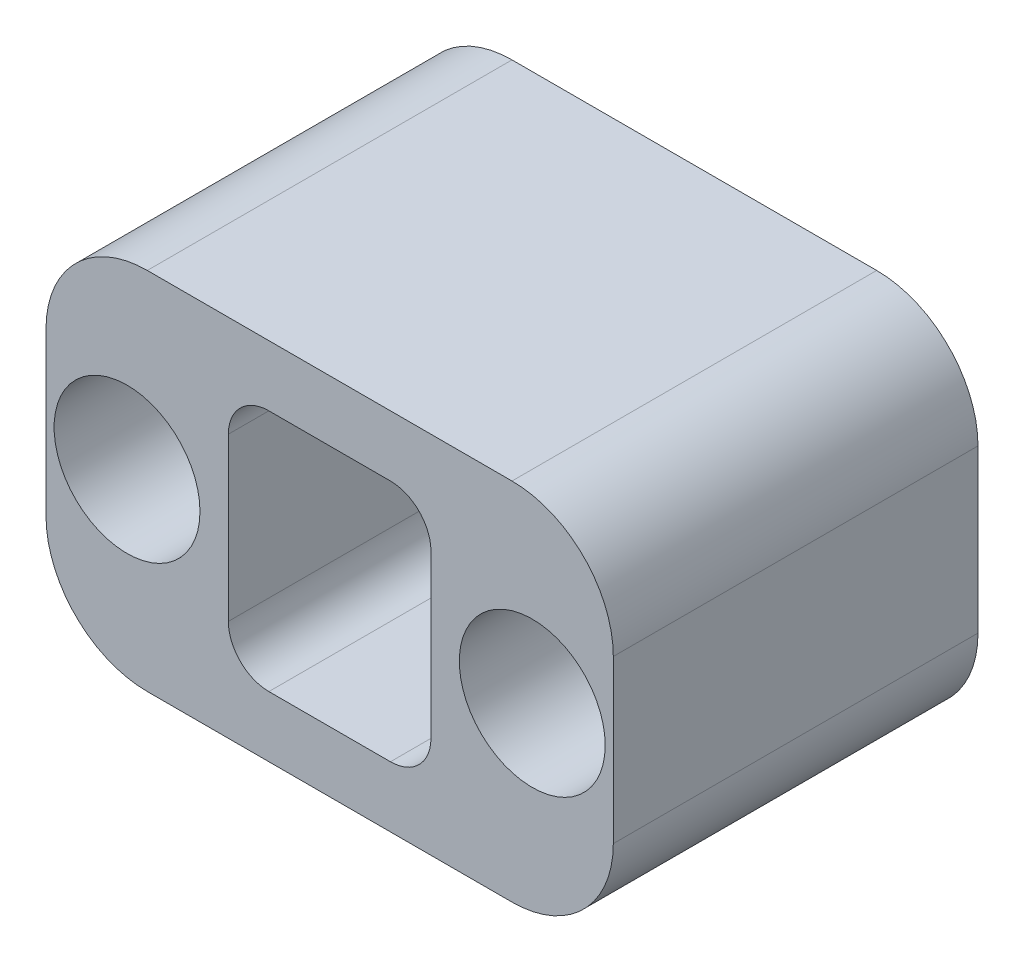
from build123d import *

# Parameters (mm, degrees)
SKETCH_1_W          = 28
SKETCH_1_H          = 18
SKETCH_1_R          = 2.1
EXTRUDE_1_DEPTH     = 18
SKETCH_2_R          = 3.6
CUT_EXTRUDE_1_DEPTH = 15
SKETCH_3_W          = 10
SKETCH_3_H          = 12
CUT_EXTRUDE_2_DEPTH = 25
FILLET_1_R          = 2
FILLET_2_R          = 5


with BuildPart() as part:
    # 草图1 → 凸台-拉伸1 (new body)
    with BuildSketch(Plane.XY):
        Rectangle(SKETCH_1_W, SKETCH_1_H)
        with Locations((-10, 0)):
            Circle(SKETCH_1_R, mode=Mode.SUBTRACT)
        with Locations((10, 0)):
            Circle(SKETCH_1_R, mode=Mode.SUBTRACT)
    extrude(amount=EXTRUDE_1_DEPTH)

    # 草图2 → 切除-拉伸1 (cut)
    with BuildSketch(Plane.XY.offset(18)):
        with Locations((-10, 0)):
            Circle(SKETCH_2_R)
        with Locations((10, 0)):
            Circle(SKETCH_2_R)
    extrude(amount=-CUT_EXTRUDE_1_DEPTH, mode=Mode.SUBTRACT)

    # 草图3 → 切除-拉伸2 (cut)
    with BuildSketch(Plane.XY.offset(18)):
        Rectangle(SKETCH_3_W, SKETCH_3_H)
    extrude(amount=-CUT_EXTRUDE_2_DEPTH, mode=Mode.SUBTRACT)

    # 圆角1
    fillet_1_edges = [part.edges().sort_by_distance(p)[0] for p in [
        (5, 6, 9),
        (5, -6, 9),
        (-5, -6, 9),
        (-5, 6, 9),
    ]]
    fillet(fillet_1_edges, radius=FILLET_1_R)

    # 圆角2
    fillet_2_edges = [part.edges().sort_by_distance(p)[0] for p in [
        (14, -9, 9),
        (-14, -9, 9),
        (-14, 9, 9),
        (14, 9, 9),
    ]]
    fillet(fillet_2_edges, radius=FILLET_2_R)


solid = part.part
